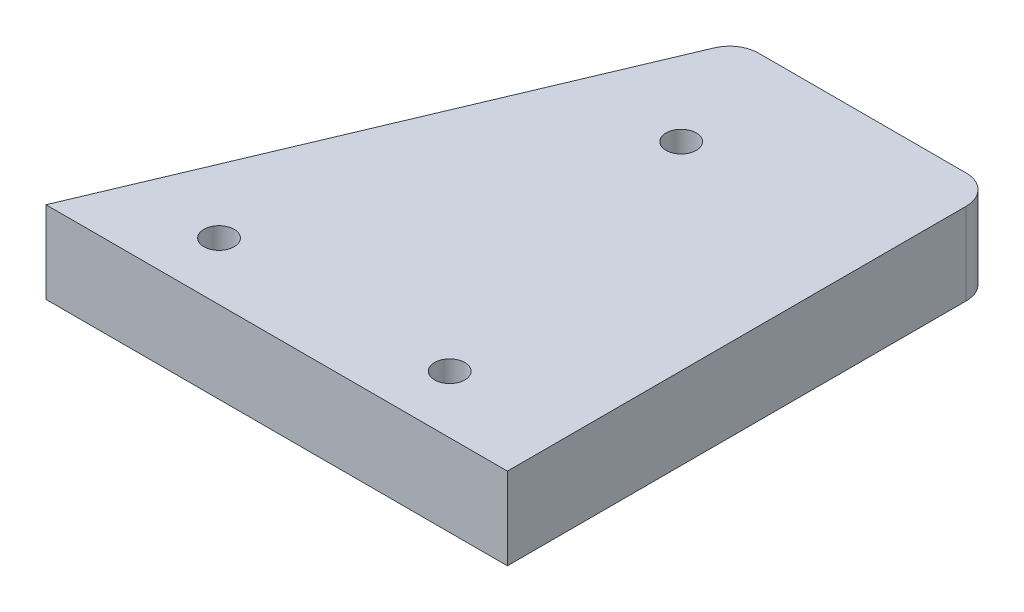
from build123d import *

# Parameters (mm, degrees)
SKETCH1_R           = 2.1
BOSS_EXTRUDE1_DEPTH = 11.38
FILLET1_R           = 4


with BuildPart() as part:
    # Sketch1 → Boss-Extrude1 (new body)
    with BuildSketch(Plane(origin=(0, 0, 0), x_dir=(1, 0, 0), z_dir=(0, 1, 0))):
        Polygon((0, 0), (64, 0), (64, 67.63), (28.533540344, 67.63), align=None)
        with Locations(Location((16, 8, 0), (0, 0, 270))):
            Circle(SKETCH1_R, mode=Mode.SUBTRACT)
        with Locations(Location((48, 8, 0), (0, 0, 270))):
            Circle(SKETCH1_R, mode=Mode.SUBTRACT)
        with Locations(Location((36.475395885, 51.63, 0), (0, 0, 270))):
            Circle(SKETCH1_R, mode=Mode.SUBTRACT)
    extrude(amount=BOSS_EXTRUDE1_DEPTH)

    # Fillet1
    fillet1_edges = [part.edges().sort_by_distance(p)[0] for p in [
        (28.533540344, 5.69, -67.63),
        (64, 5.69, -67.63),
    ]]
    fillet(fillet1_edges, radius=FILLET1_R)


solid = part.part
